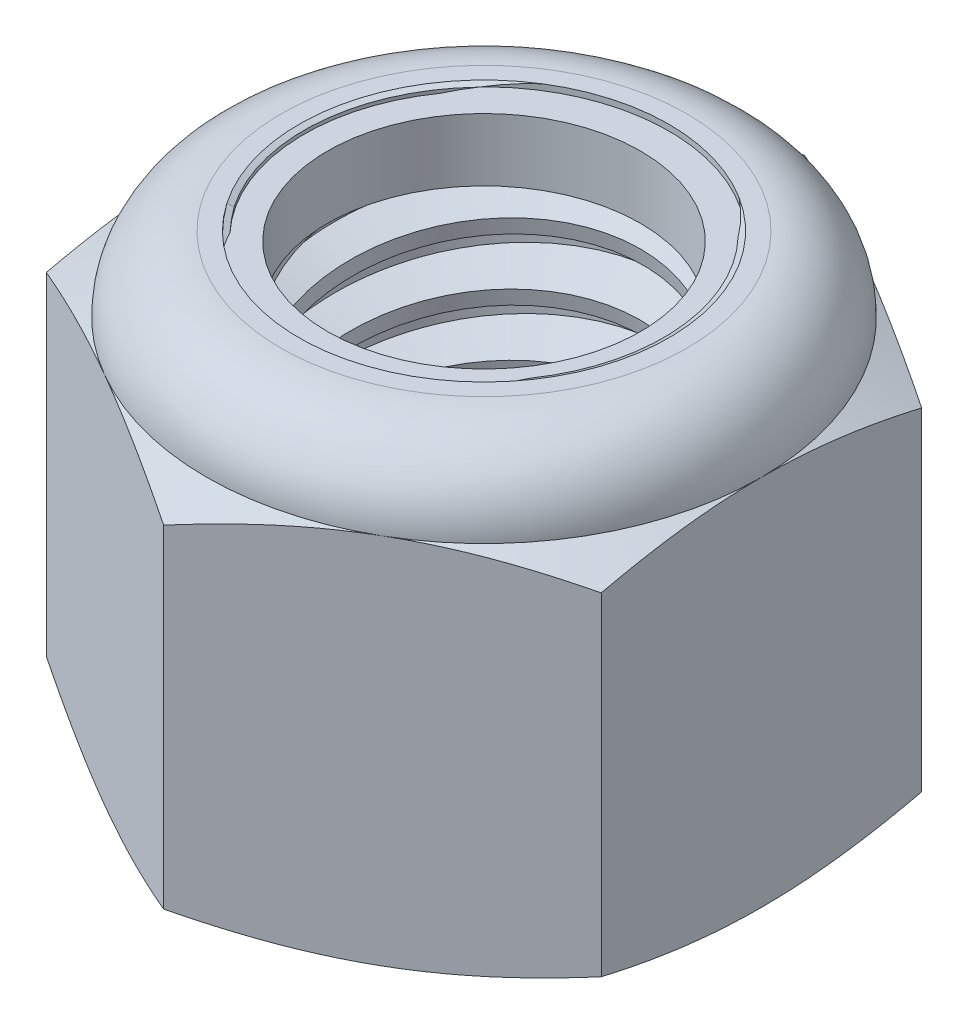
from build123d import *

# Parameters (mm, degrees)
EXTRUDE1_DEPTH      = 11.509375
SKETCH2_W           = 4.7625
SKETCH2_H           = 11.509375
LPATTERN1_COUNT     = 7
LPATTERN1_PITCH     = 1.5875
LPATTERN1_COL_COUNT = 2
LPATTERN1_COL_PITCH = 1.5875


with BuildPart() as part:
    # Sketch1 → Extrude1 (new body)
    with BuildSketch(Plane(origin=(0, 0, 0), x_dir=(1, 0, 0), z_dir=(0, 1, 0))):
        Polygon((0, 8.248891971), (-7.14375, 4.124445986), (-7.14375, -4.124445986), (0, -8.248891971), (7.14375, -4.124445986), (7.14375, 4.124445986), align=None)
    extrude(amount=EXTRUDE1_DEPTH)

    # Sketch4 → Cut-Revolve2 (revolve, cut)
    with BuildSketch(Plane(origin=(0, 0, 0), x_dir=(0, 0, -1), z_dir=(1, 0, 0)), mode=Mode.PRIVATE) as cut_revolve2_sk:
        Polygon((0, 11.509375), (4.7625, 11.509375), (4.029111805, 11.167390468), (4.029111805, 0.341984532), (4.7625, 0), (0, 0), align=None)
    revolve(cut_revolve2_sk.sketch.rotate(Axis((0, 11.509375, 0), (0, 1, 0)), 55.157981045), axis=Axis((0, 11.509375, 0), (0, 1, 0)), mode=Mode.SUBTRACT)


with BuildPart() as body_2:
    # Sketch2 → Revolve1 (revolve)
    with BuildSketch(Plane(origin=(0, 0, 0), x_dir=(0, 0, -1), z_dir=(1, 0, 0))):
        with Locations((2.38125, 5.7546875)):
            Rectangle(SKETCH2_W, SKETCH2_H)
    revolve(axis=Axis((0, -4.7625, 0), (0, 1, 0)))

    # Sketch3 → Cut-Revolve1 (revolve, cut)
    with BuildSketch(Plane(origin=(0, 0, 0), x_dir=(0, 0, -1), z_dir=(1, 0, 0)), mode=Mode.PRIVATE) as cut_revolve1_sk:
        Polygon((4.795122924, 11.313637456), (5.023483392, 9.943474646), (4.094357653, 10.291557102), (4.029111805, 10.68303219), align=None)
    cut_revolve1 = revolve(cut_revolve1_sk.sketch.rotate(Axis((0, 11.509375, 0.28317269), (0, -0.9863939238321437, -0.16439898730535768)), 180), axis=Axis((0, 11.509375, 0.28317269), (0, -0.9863939238321437, -0.16439898730535768)), mode=Mode.SUBTRACT)

    # LPattern1: Cut-Revolve1 ×7
    with Locations(*[(0, -i * LPATTERN1_PITCH, 0) for i in range(1, LPATTERN1_COUNT)]):
        add(cut_revolve1, mode=Mode.SUBTRACT)

    # LPattern1 col: Cut-Revolve1 ×2
    with Locations(*[(0, i * LPATTERN1_COL_PITCH, 0) for i in range(1, LPATTERN1_COL_COUNT)]):
        add(cut_revolve1, mode=Mode.SUBTRACT)


with BuildPart() as part_1:
    add(part.part)

    # Combine1: cut body 2
    add(body_2.part, mode=Mode.SUBTRACT)

    # Sketch5 → Cut-Revolve3 (revolve, cut)
    with BuildSketch(Plane(origin=(0, 0, 0), x_dir=(0, 0, -1), z_dir=(1, 0, 0)), mode=Mode.PRIVATE) as cut_revolve3_sk:
        with BuildLine():
            Line((0, 0), (7.14375, 0))
            Line((7.14375, 0), (8.248891971, 0.515336164))
            Line((8.248891971, 0.515336164), (8.248891971, 9.075809669))
            Line((8.248891971, 9.075809669), (7.14375, 9.591145833))
            ThreePointArc((7.14375, 9.591145833), (6.581913685, 10.947538685), (5.225520833, 11.509375))
            Line((5.225520833, 11.509375), (5.225520833, 12.779375))
            Line((5.225520833, 12.779375), (9.518891971, 12.779375))
            Line((9.518891971, 12.779375), (9.518891971, -1.27))
            Line((9.518891971, -1.27), (0, -1.27))
            Line((0, -1.27), (0, 0))
        make_face()
    revolve(cut_revolve3_sk.sketch.rotate(Axis((0, 0, 0), (0, 1, 0)), 55.157981045), axis=Axis((0, 0, 0), (0, 1, 0)), mode=Mode.SUBTRACT)

    # Sketch6 → Cut-Revolve4 (revolve, cut)
    with BuildSketch(Plane(origin=(0, 0, 0), x_dir=(0, 0, -1), z_dir=(1, 0, 0)), mode=Mode.PRIVATE) as cut_revolve4_sk:
        with BuildLine():
            Line((0, 9.591145833), (6.99135, 9.591145833))
            ThreePointArc((6.99135, 9.591145833), (6.474150612, 10.839775612), (5.225520833, 11.356975))
            Line((5.225520833, 11.356975), (4.627316319, 11.356975))
            Line((4.627316319, 11.356975), (4.627316319, 12.779375))
            Line((4.627316319, 12.779375), (0, 12.779375))
            Line((0, 12.779375), (0, 9.591145833))
        make_face()
    revolve(cut_revolve4_sk.sketch.rotate(Axis((0, 12.779375, 0), (0, 1, 0)), 55.157981045), axis=Axis((0, 12.779375, 0), (0, 1, 0)), mode=Mode.SUBTRACT)


with BuildPart() as body_2_2:
    # Sketch7 → Revolve2 (revolve)
    with BuildSketch(Plane(origin=(0, 0, 0), x_dir=(0, 0, -1), z_dir=(1, 0, 0)), mode=Mode.PRIVATE) as revolve2_sk:
        with BuildLine():
            Line((4.029111805, 9.667345833), (6.913430867, 9.667345833))
            ThreePointArc((6.913430867, 9.667345833), (6.39301751, 10.812537757), (5.225520833, 11.280775))
            Line((5.225520833, 11.280775), (4.029111805, 11.280775))
            Line((4.029111805, 11.280775), (4.029111805, 9.667345833))
        make_face()
    revolve(revolve2_sk.sketch.rotate(Axis((0, 9.667345833, 0), (0, 1, 0)), 55.157981045), axis=Axis((0, 9.667345833, 0), (0, 1, 0)))


solid = Compound([part_1.part, body_2_2.part])
